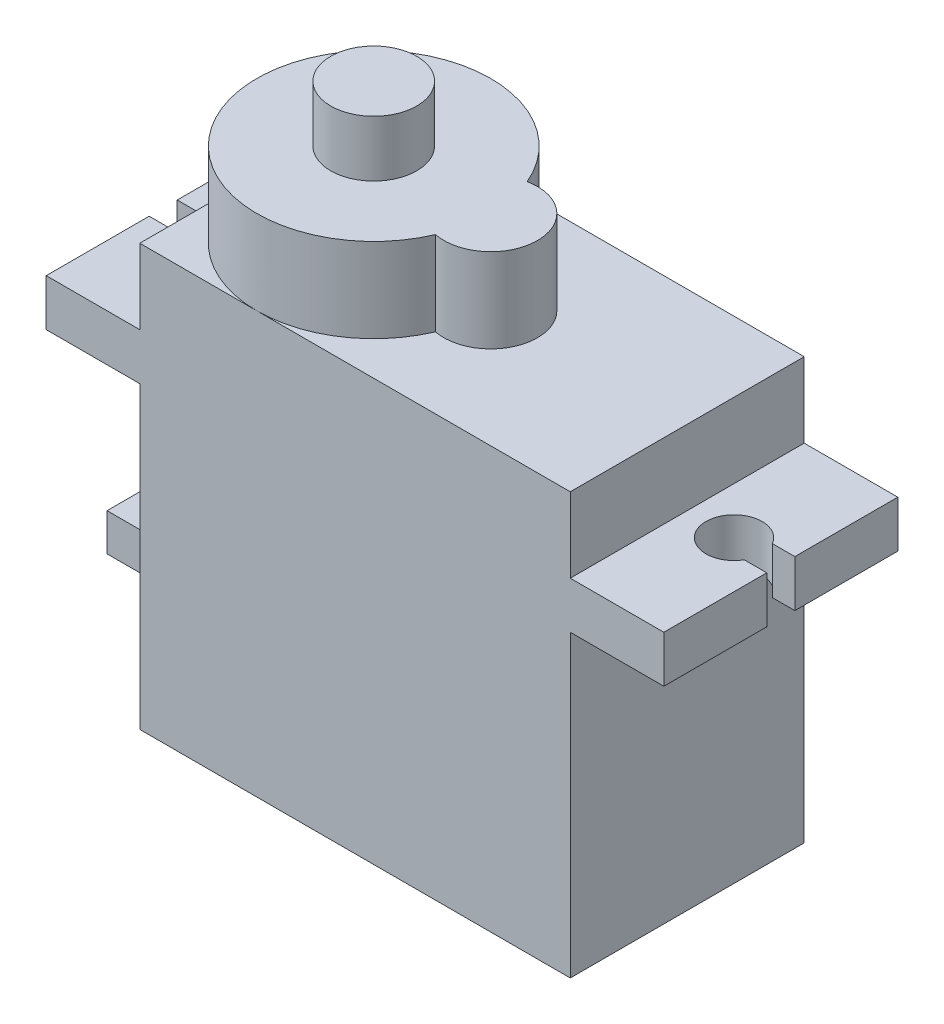
from build123d import *

# Parameters (mm, degrees)
SKETCH1_W           = 23
SKETCH1_H           = 12.5
BOSS_EXTRUDE1_DEPTH = 22.5
BOSS_EXTRUDE2_DEPTH = 2.5
BOSS_EXTRUDE3_DEPTH = 4.5
SKETCH4_R           = 2.3
BOSS_EXTRUDE4_DEPTH = 3
SKETCH6_W           = 6
SKETCH6_H           = 2
BOSS_EXTRUDE6_DEPTH = 5


with BuildPart() as part:
    # Sketch1 → Boss-Extrude1 (new body)
    with BuildSketch(Plane(origin=(0, 0, 0), x_dir=(1, 0, 0), z_dir=(0, 1, 0))):
        Rectangle(SKETCH1_W, SKETCH1_H)
    extrude(amount=BOSS_EXTRUDE1_DEPTH)

    # Sketch2 → Boss-Extrude2 (add)
    with BuildSketch(Plane(origin=(0, 16, 0), x_dir=(1, 0, 0), z_dir=(0, 1, 0))):
        with BuildLine():
            Line((11.5, 6.25), (16.5, 6.25))
            Line((16.5, 6.25), (16.5, 0.75))
            Line((16.5, 0.75), (15.299038106, 0.75))
            ThreePointArc((15.299038106, 0.75), (12.5, 0), (15.299038106, -0.75))
            Line((15.299038106, -0.75), (16.5, -0.75))
            Line((16.5, -0.75), (16.5, -6.25))
            Line((16.5, -6.25), (11.5, -6.25))
            Line((11.5, -6.25), (11.5, 6.25))
        make_face()
        with BuildLine():
            Line((-11.5, 6.25), (-11.5, -6.25))
            Line((-11.5, -6.25), (-16.5, -6.25))
            Line((-16.5, -6.25), (-16.5, -0.75))
            Line((-16.5, -0.75), (-15.299038106, -0.75))
            ThreePointArc((-15.299038106, -0.75), (-12.5, 0), (-15.299038106, 0.75))
            Line((-15.299038106, 0.75), (-16.5, 0.75))
            Line((-16.5, 0.75), (-16.5, 6.25))
            Line((-16.5, 6.25), (-11.5, 6.25))
        make_face()
    extrude(amount=BOSS_EXTRUDE2_DEPTH)

    # Sketch3 → Boss-Extrude3 (add)
    with BuildSketch(Plane(origin=(0, 22.5, 0), x_dir=(1, 0, 0), z_dir=(0, 1, 0))):
        with BuildLine():
            ThreePointArc((0.5, 2.449489743), (-11.5, 0), (0.5, -2.449489743))
            ThreePointArc((0.5, -2.449489743), (3.5, 0), (0.5, 2.449489743))
        make_face()
    extrude(amount=BOSS_EXTRUDE3_DEPTH)

    # Sketch4 → Boss-Extrude4 (add)
    with BuildSketch(Plane(origin=(0, 27, 0), x_dir=(1, 0, 0), z_dir=(0, 1, 0))):
        with Locations(Location((-5.25, 0, 0), (0, 0, 270))):
            Circle(SKETCH4_R)
    extrude(amount=BOSS_EXTRUDE4_DEPTH)

    # Sketch6 → Boss-Extrude6 (add)
    with BuildSketch(Plane.ZY.offset(11.5)):
        with Locations((0, 5)):
            Rectangle(SKETCH6_W, SKETCH6_H)
    extrude(amount=BOSS_EXTRUDE6_DEPTH)


solid = part.part
